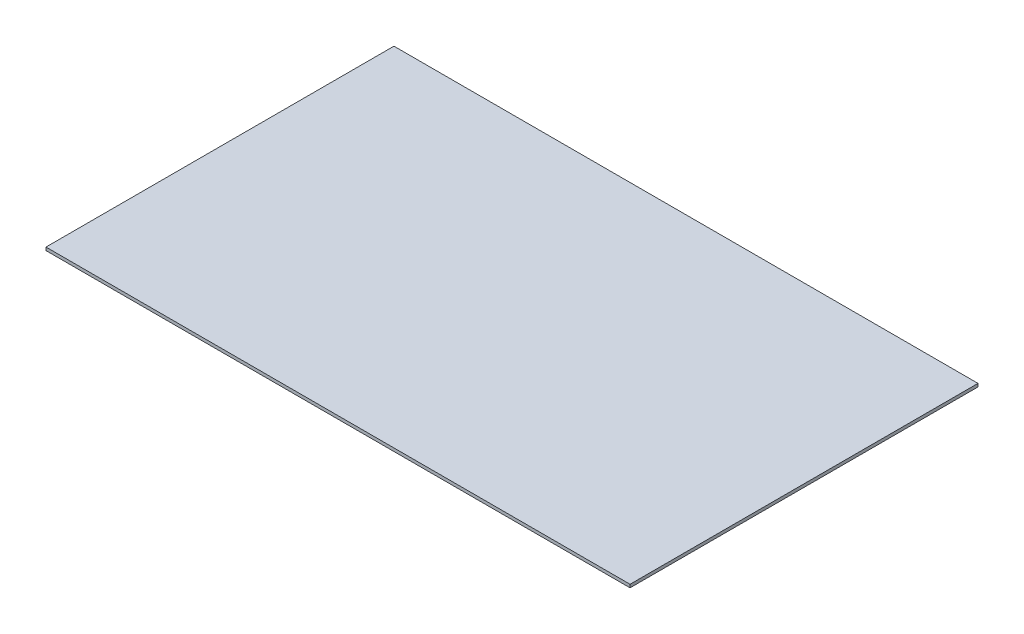
from build123d import *

# Parameters (mm, degrees)
SKETCH1_W           = 596.9
SKETCH1_H           = 355.6
BOSS_EXTRUDE1_DEPTH = 3.175


with BuildPart() as part:
    # Sketch1 → Boss-Extrude1 (new body)
    with BuildSketch(Plane(origin=(0, 0, 0), x_dir=(1, 0, 0), z_dir=(0, 1, 0))):
        with Locations((298.45, -177.8)):
            Rectangle(SKETCH1_W, SKETCH1_H)
    extrude(amount=BOSS_EXTRUDE1_DEPTH)


solid = part.part
